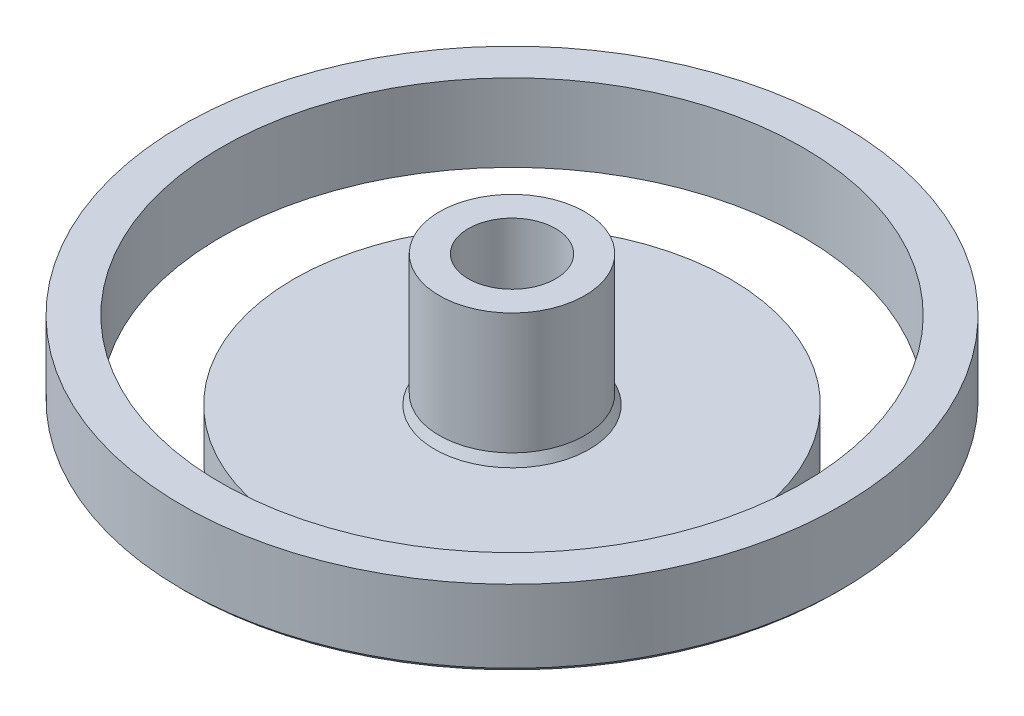
from build123d import *

# Parameters (mm, degrees)
SCHIZZO1_W   = 8
SCHIZZO1_H   = 16
SMUSSO2_SIZE = 1
RACCORDO1_R  = 1
RACCORDO2_R  = 0.2
SMUSSO3_SIZE = 1


with BuildPart() as part:
    # Schizzo1 → Rivoluzione1 (revolve)
    with BuildSketch(Plane.XY, mode=Mode.PRIVATE) as rivoluzione1_sk:
        with Locations((-64, 18)):
            Rectangle(SCHIZZO1_W, SCHIZZO1_H)
        Polygon((-45, 10), (-45, 0), (-34.4, 0), (-34.4, 1.3), (-32, 1.3), (-32, 0), (-29.5, 0), (-29.5, 1.3), (-27.1, 1.3), (-27.1, 0), (-24, 0), (-24, 5), (-18.4, 5), (-18.4, 6.3), (-16, 6.3), (-16, 5), (-13, 5), (-9, 13.5), (-9, 37), (-15, 37), (-15, 12), (-15.941176471, 10), align=None)
    revolve(rivoluzione1_sk.sketch.rotate(Axis((0, 0, 0), (0, 1, 0)), 270), axis=Axis((0, 0, 0), (0, 1, 0)))

    # Smusso2
    smusso2_edges = [part.edges().sort_by_distance(p)[0] for p in [
        (0, 0, 24),
    ]]
    chamfer(smusso2_edges, length=SMUSSO2_SIZE)

    # Raccordo1
    raccordo1_edges = [part.edges().sort_by_distance(p)[0] for p in [
        (0, 5, 24),
    ]]
    fillet(raccordo1_edges, radius=RACCORDO1_R)

    # Raccordo2
    raccordo2_edges = [part.edges().sort_by_distance(p)[0] for p in [
        (0, 6.3, 16),
        (0, 6.3, 18.4),
        (0, 1.3, 27.1),
        (0, 1.3, 29.5),
        (0, 1.3, 32),
        (0, 1.3, 34.4),
    ]]
    fillet(raccordo2_edges, radius=RACCORDO2_R)

    # Smusso3
    smusso3_edges = [part.edges().sort_by_distance(p)[0] for p in [
        (0, 10, 68),
    ]]
    chamfer(smusso3_edges, length=SMUSSO3_SIZE)


solid = part.part
